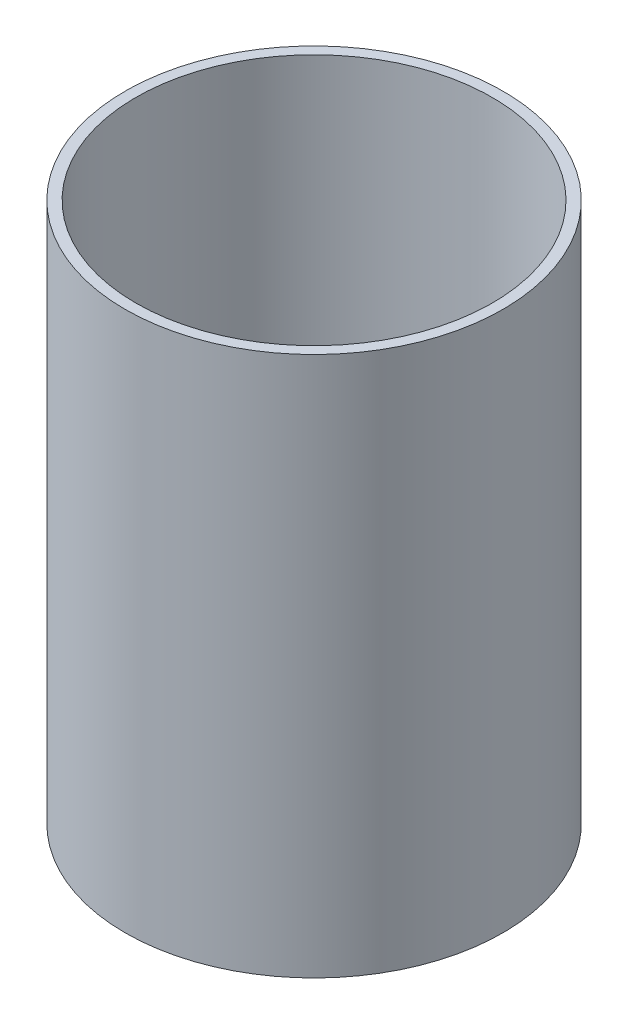
from build123d import *

# Parameters (mm, degrees)
SKETCH1_R           = 17.5
SKETCH1_R_2         = 16.5
BOSS_EXTRUDE1_DEPTH = 50
SKETCH1_2_R         = 17.5
BOSS_EXTRUDE2_DEPTH = 2


with BuildPart() as part:
    # Sketch1 → Boss-Extrude1 (new body)
    with BuildSketch(Plane(origin=(0, 0, 0), x_dir=(1, 0, 0), z_dir=(0, 1, 0))):
        Circle(SKETCH1_R)
        Circle(SKETCH1_R_2, mode=Mode.SUBTRACT)
    extrude(amount=BOSS_EXTRUDE1_DEPTH)

    # Sketch1<2> → Boss-Extrude2 (add)
    with BuildSketch(Plane(origin=(0, 0, 0), x_dir=(1, 0, 0), z_dir=(0, 1, 0))):
        Circle(SKETCH1_2_R)
    extrude(amount=BOSS_EXTRUDE2_DEPTH)


solid = part.part
